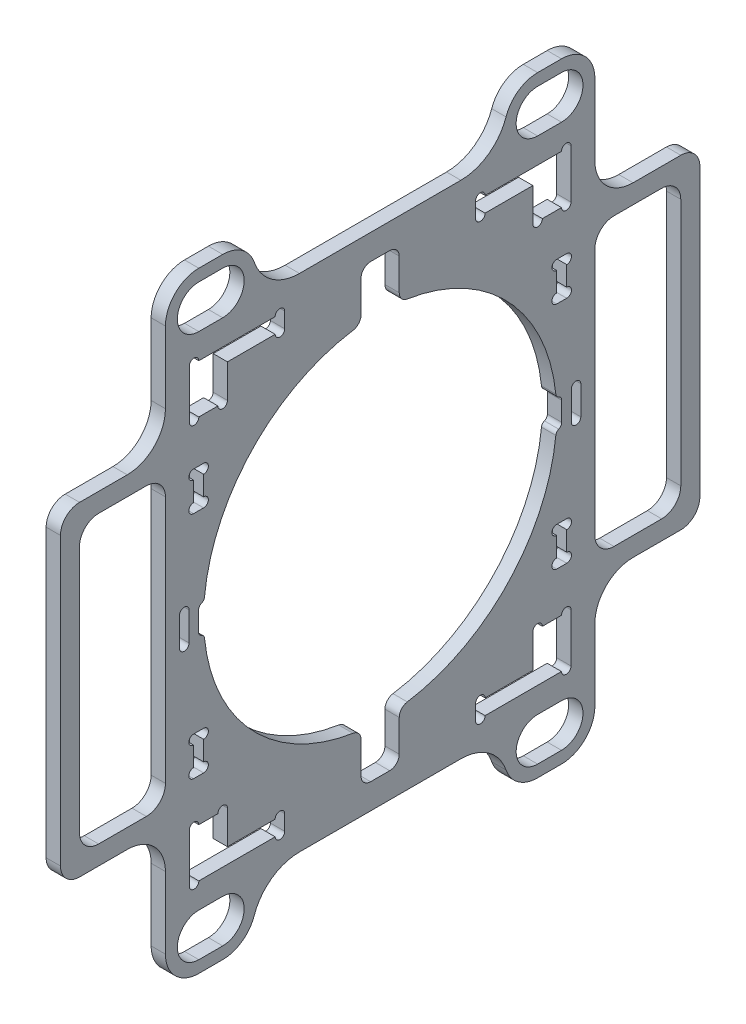
from build123d import *

# Parameters (mm, degrees)
SKETCH_1_W                = 90
SKETCH_1_H                = 105
SKETCH_1_R                = 37
EXTRUDE_1_DEPTH           = 3
FILLET_1_R                = 3
CUT_EXTRUDE_2_DEPTH       = 10
MIRROR_2_COPY_1_DEPTH     = 10
SKETCH_5_W                = 8
SKETCH_5_H                = 14.302029303
CUT_EXTRUDE_3_DEPTH       = 10
SKETCH_6_W                = 2.1
SKETCH_6_H                = 8.1
CUT_EXTRUDE_4_DEPTH       = 10
MIRROR_5_COPY_1_SKETCH_W  = 2.1
MIRROR_5_COPY_1_SKETCH_H  = 8.1
MIRROR_5_COPY_1_DEPTH     = 10
SKETCH_7_R                = 1
SKETCH_7_W                = 2
SKETCH_7_H                = 6
CUT_EXTRUDE_5_DEPTH       = 10
EXTRUDE_2_DEPTH           = 3
FILLET_2_R                = 4
FILLET_3_R                = 8
EXTRUDE_3_DEPTH           = 3
FILLET_4_R                = 10
FILLET_4_OF_MIRROR_8_R    = 10
FILLET_5_R                = 1
SKETCH_10_R               = 1
CUT_EXTRUDE_6_DEPTH       = 10
MIRROR_10_COPY_1_SKETCH_R = 1
MIRROR_10_COPY_1_DEPTH    = 10
FILLET_6_R                = 2


with BuildPart() as part:
    # 草图1 → 凸台-拉伸1 (new body)
    with BuildSketch(Plane(origin=(0, 0, 0), x_dir=(0, 0, -1), z_dir=(1, 0, 0))):
        Rectangle(SKETCH_1_W, SKETCH_1_H)
        Circle(SKETCH_1_R, mode=Mode.SUBTRACT)
    extrude(amount=EXTRUDE_1_DEPTH)

    # 圆角1
    fillet_1_edges = [part.edges().sort_by_distance(p)[0] for p in [
        (1.5, 52.5, 45),
        (1.5, 52.5, -45),
        (1.5, -52.5, -45),
        (1.5, -52.5, 45),
    ]]
    fillet(fillet_1_edges, radius=FILLET_1_R)

    # 草图4 → 切除-拉伸2 (cut)
    with BuildSketch(Plane.ZY):
        Polygon((-32, -44), (-20, -44), (-20, -47.2), (-40, -47.2), (-40, -44), (-40, -37), (-32, -37), align=None)
    cut_extrude_2 = extrude(amount=-CUT_EXTRUDE_2_DEPTH, mode=Mode.SUBTRACT)

    # 镜向1: 切除-拉伸2 across plane
    add(cut_extrude_2.mirror(Plane.XY), mode=Mode.SUBTRACT)

    # 镜向2: 切除-拉伸2 across plane
    add(cut_extrude_2.mirror(Plane.ZX), mode=Mode.SUBTRACT)

    # 镜向2 copy 1 sketch → 镜向2 copy 1 (cut)
    with BuildSketch(Plane(origin=(0, 0, 0), x_dir=(0, 0, -1), z_dir=(-1, 0, 0))):
        Polygon((-32, -44), (-20, -44), (-20, -47.2), (-40, -47.2), (-40, -44), (-40, -37), (-32, -37), align=None)
    extrude(amount=-MIRROR_2_COPY_1_DEPTH, mode=Mode.SUBTRACT)

    # 草图5 → 切除-拉伸3 (cut)
    with BuildSketch(Plane.ZY):
        with Locations((0, 40.048985349)):
            Rectangle(SKETCH_5_W, SKETCH_5_H)
    cut_extrude_3 = extrude(amount=-CUT_EXTRUDE_3_DEPTH, mode=Mode.SUBTRACT)

    # 镜向3: 切除-拉伸3 across plane
    add(cut_extrude_3.mirror(Plane.ZX), mode=Mode.SUBTRACT)

    # 草图6 → 切除-拉伸4 (cut)
    with BuildSketch(Plane.ZY):
        with Locations((38.05, -24.05)):
            Rectangle(SKETCH_6_W, SKETCH_6_H)
    cut_extrude_4 = extrude(amount=-CUT_EXTRUDE_4_DEPTH, mode=Mode.SUBTRACT)

    # 镜向4: 切除-拉伸4 across plane
    add(cut_extrude_4.mirror(Plane.ZX), mode=Mode.SUBTRACT)

    # 镜向5: 切除-拉伸4 across plane
    add(cut_extrude_4.mirror(Plane.XY), mode=Mode.SUBTRACT)

    # 镜向5 copy 1 sketch → 镜向5 copy 1 (cut)
    with BuildSketch(Plane(origin=(0, 0, 0), x_dir=(0, 0, -1), z_dir=(-1, 0, 0))):
        with Locations((38.05, -24.05)):
            Rectangle(MIRROR_5_COPY_1_SKETCH_W, MIRROR_5_COPY_1_SKETCH_H)
    extrude(amount=-MIRROR_5_COPY_1_DEPTH, mode=Mode.SUBTRACT)

    # 草图7 → 切除-拉伸5 (cut)
    with BuildSketch(Plane.ZY):
        with Locations((41.05, 3)):
            Circle(SKETCH_7_R)
        with Locations((41.05, -3)):
            Circle(SKETCH_7_R)
        with Locations((41.05, 0)):
            Rectangle(SKETCH_7_W, SKETCH_7_H)
        with BuildLine():
            Line((27.329586198, -3), (37.05, -3))
            ThreePointArc((37.05, -3), (37.757106781, -2.707106781), (38.05, -2))
            Line((38.05, -2), (38.05, 2))
            ThreePointArc((38.05, 2), (37.757106781, 2.707106781), (37.05, 3))
            Line((37.05, 3), (27.329586198, 3))
            Line((27.329586198, 3), (27.329586198, -3))
        make_face()
    cut_extrude_5 = extrude(amount=-CUT_EXTRUDE_5_DEPTH, mode=Mode.SUBTRACT)

    # 镜向6: 切除-拉伸5 across plane
    add(cut_extrude_5.mirror(Plane.XY), mode=Mode.SUBTRACT)

    # 草图8 → 凸台-拉伸2 (add)
    with BuildSketch(Plane.ZY):
        Polygon((63, 30), (63, -30), (45, -30), (45, -34), (67, -34), (67, 34), (45, 34), (45, 30), align=None)
    extrude_2 = extrude(amount=-EXTRUDE_2_DEPTH)

    # 镜向7: 凸台-拉伸2 across plane
    add(extrude_2.mirror(Plane.XY))

    # 圆角2
    fillet_2_edges = [part.edges().sort_by_distance(p)[0] for p in [
        (1.5, -30, 45),
        (1.5, -30, 63),
        (1.5, 30, 63),
        (1.5, 30, 45),
        (1.5, 34, 67),
        (1.5, -34, 67),
        (1.5, -30, -45),
        (1.5, -34, -67),
        (1.5, 34, -67),
        (1.5, 30, -45),
        (1.5, 30, -63),
        (1.5, -30, -63),
    ]]
    fillet(fillet_2_edges, radius=FILLET_2_R)

    # 圆角3
    fillet_3_edges = [part.edges().sort_by_distance(p)[0] for p in [
        (1.5, -34, 45),
        (1.5, 34, 45),
        (1.5, -34, -45),
        (1.5, 34, -45),
    ]]
    fillet(fillet_3_edges, radius=FILLET_3_R)

    # 草图9 → 凸台-拉伸3 (add)
    # profile 1 of 4: a face of its own
    with BuildSketch(Plane.ZY):
        with BuildLine():
            ThreePointArc((38, -50), (45, -57), (38, -64))
            Line((38, -64), (33, -64))
            ThreePointArc((33, -64), (26, -57), (33, -50))
            Line((33, -50), (38, -50))
        make_face()
        with BuildLine():
            Line((33, -52.5), (38, -52.5))
            ThreePointArc((38, -52.5), (42.5, -57), (38, -61.5))
            Line((38, -61.5), (33, -61.5))
            ThreePointArc((33, -61.5), (28.5, -57), (33, -52.5))
        make_face(mode=Mode.SUBTRACT)
    # profile 2 of 4: a face of its own
    with BuildSketch(Plane.ZY):
        with BuildLine():
            Line((26, -47.247669706), (26, -57))
            ThreePointArc((26, -57), (28.050252532, -52.050252532), (33, -50))
            Line((33, -50), (38, -50))
            ThreePointArc((38, -50), (42.949747468, -52.050252532), (45, -57))
            Line((45, -57), (45, -47.247669706))
            Line((45, -47.247669706), (26, -47.247669706))
        make_face()
    # profile 3 of 4: a face of its own
    with BuildSketch(Plane.ZY):
        with BuildLine():
            ThreePointArc((38, 50), (45, 57), (38, 64))
            Line((38, 64), (33, 64))
            ThreePointArc((33, 64), (26, 57), (33, 50))
            Line((33, 50), (38, 50))
        make_face()
        with BuildLine():
            ThreePointArc((38, 52.5), (42.5, 57), (38, 61.5))
            Line((38, 61.5), (33, 61.5))
            ThreePointArc((33, 61.5), (28.5, 57), (33, 52.5))
            Line((33, 52.5), (38, 52.5))
        make_face(mode=Mode.SUBTRACT)
    # profile 4 of 4: a face of its own
    with BuildSketch(Plane.ZY):
        with BuildLine():
            ThreePointArc((33, 50), (28.050252532, 52.050252532), (26, 57))
            Line((26, 57), (26, 47.247669706))
            Line((26, 47.247669706), (45, 47.247669706))
            Line((45, 47.247669706), (45, 57))
            ThreePointArc((45, 57), (42.949747468, 52.050252532), (38, 50))
            Line((38, 50), (33, 50))
        make_face()
    extrude_3 = extrude(amount=-EXTRUDE_3_DEPTH)

    # 圆角4
    fillet_4_edges = [part.edges().sort_by_distance(p)[0] for p in [
        (1.5, 52.5, 26),
        (1.5, -52.5, 26),
    ]]
    fillet(fillet_4_edges, radius=FILLET_4_R)

    # 镜向8: 凸台-拉伸3 across plane
    add(extrude_3.mirror(Plane.XY))

    # 圆角4 of 镜向8
    fillet_4_of_mirror_8_edges = [part.edges().sort_by_distance(p)[0] for p in [
        (1.5, 52.5, -26),
        (1.5, -52.5, -26),
    ]]
    fillet(fillet_4_of_mirror_8_edges, radius=FILLET_4_OF_MIRROR_8_R)

    # 圆角5
    fillet_5_edges = [part.edges().sort_by_distance(p)[0] for p in [
        (1.5, 3, -36.878177829),
        (1.5, -3, -36.878177829),
        (1.5, 3, 36.878177829),
        (1.5, -3, 36.878177829),
    ]]
    fillet(fillet_5_edges, radius=FILLET_5_R)

    # 草图10 → 切除-拉伸6 (cut)
    with BuildSketch(Plane.ZY):
        with Locations((37, -27.1)):
            Circle(SKETCH_10_R)
        with Locations((39.1, -27.1)):
            Circle(SKETCH_10_R)
        with Locations((39.1, -21)):
            Circle(SKETCH_10_R)
        with Locations((37, -21)):
            Circle(SKETCH_10_R)
        with Locations((39, -37)):
            Circle(SKETCH_10_R)
        with Locations((33, -37)):
            Circle(SKETCH_10_R)
        with Locations((39, -47.2)):
            Circle(SKETCH_10_R)
        with Locations((21, -47.2)):
            Circle(SKETCH_10_R)
        with Locations((21, -44)):
            Circle(SKETCH_10_R)
    cut_extrude_6 = extrude(amount=-CUT_EXTRUDE_6_DEPTH, mode=Mode.SUBTRACT)

    # 镜向9: 切除-拉伸6 across plane
    add(cut_extrude_6.mirror(Plane.ZX), mode=Mode.SUBTRACT)

    # 镜向10: 切除-拉伸6 across plane
    add(cut_extrude_6.mirror(Plane.XY), mode=Mode.SUBTRACT)

    # 镜向10 copy 1 sketch → 镜向10 copy 1 (cut)
    with BuildSketch(Plane(origin=(0, 0, 0), x_dir=(0, 0, -1), z_dir=(-1, 0, 0))):
        with Locations((37, -27.1)):
            Circle(MIRROR_10_COPY_1_SKETCH_R)
        with Locations((39.1, -27.1)):
            Circle(MIRROR_10_COPY_1_SKETCH_R)
        with Locations((39.1, -21)):
            Circle(MIRROR_10_COPY_1_SKETCH_R)
        with Locations((37, -21)):
            Circle(MIRROR_10_COPY_1_SKETCH_R)
        with Locations((39, -37)):
            Circle(MIRROR_10_COPY_1_SKETCH_R)
        with Locations((33, -37)):
            Circle(MIRROR_10_COPY_1_SKETCH_R)
        with Locations((39, -47.2)):
            Circle(MIRROR_10_COPY_1_SKETCH_R)
        with Locations((21, -47.2)):
            Circle(MIRROR_10_COPY_1_SKETCH_R)
        with Locations((21, -44)):
            Circle(MIRROR_10_COPY_1_SKETCH_R)
    extrude(amount=-MIRROR_10_COPY_1_DEPTH, mode=Mode.SUBTRACT)

    # 圆角6
    fillet_6_edges = [part.edges().sort_by_distance(p)[0] for p in [
        (1.5, 36.783148315, 4),
        (1.5, 36.783148315, -4),
        (1.5, 47.2, -4),
        (1.5, 47.2, 4),
        (1.5, -36.783148315, 4),
        (1.5, -36.783148315, -4),
        (1.5, -47.2, -4),
        (1.5, -47.2, 4),
    ]]
    fillet(fillet_6_edges, radius=FILLET_6_R)


solid = part.part
